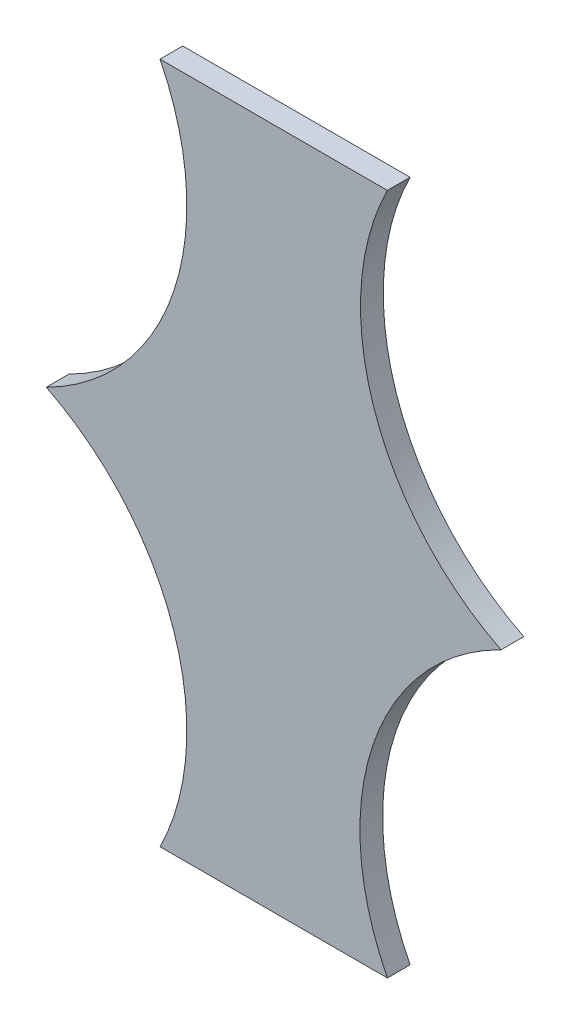
from build123d import *

# Parameters (mm, degrees)
BOSS_EXTRUDE3_DEPTH = 20


with BuildPart() as part:
    # Sketch1 → Boss-Extrude3 (new body)
    with BuildSketch(Plane(origin=(0, 0, 0), x_dir=(0, 1, 0), z_dir=(0, 0, 1))):
        with BuildLine():
            Line((-499.964762884, 99.942839206), (-499.964762884, 299.914874032))
            ThreePointArc((-499.964762884, 299.914874032), (-329.254073158, 287.832700506), (-200, 400))
            ThreePointArc((-200, 400), (-70.745926842, 287.832700506), (99.964762884, 299.914874032))
            Line((99.964762884, 299.914874032), (99.964762884, 99.964762884))
            ThreePointArc((99.964762884, 99.964762884), (-70.720998831, 112.107117952), (-200, 0))
            ThreePointArc((-200, 0), (-329.071309069, 112.733143363), (-499.964762884, 99.942839206))
        make_face()
    extrude(amount=BOSS_EXTRUDE3_DEPTH)


solid = part.part
